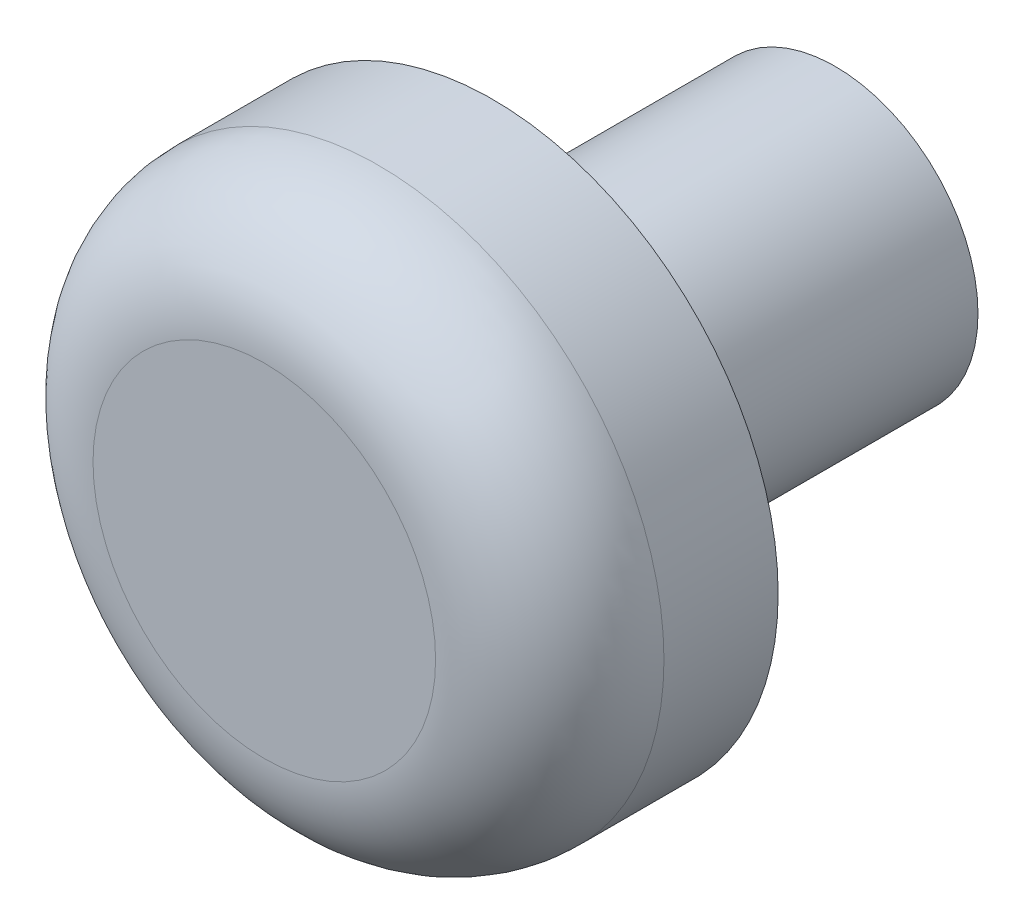
from build123d import *

# Parameters (mm, degrees)
SKETCH1_R           = 1.25
BOSS_EXTRUDE1_DEPTH = 3
SKETCH2_R           = 2.5
BOSS_EXTRUDE2_DEPTH = 2
FILLET1_R           = 1


with BuildPart() as part:
    # Sketch1 → Boss-Extrude1 (new body)
    with BuildSketch(Plane.XY):
        Circle(SKETCH1_R)
    extrude(amount=BOSS_EXTRUDE1_DEPTH)

    # Sketch2 → Boss-Extrude2 (add)
    with BuildSketch(Plane.XY.offset(3)):
        Circle(SKETCH2_R)
    extrude(amount=BOSS_EXTRUDE2_DEPTH)

    # Fillet1
    fillet1_edges = [part.edges().sort_by_distance(p)[0] for p in [
        (-2.5, 0, 5),
    ]]
    fillet(fillet1_edges, radius=FILLET1_R)


solid = part.part
